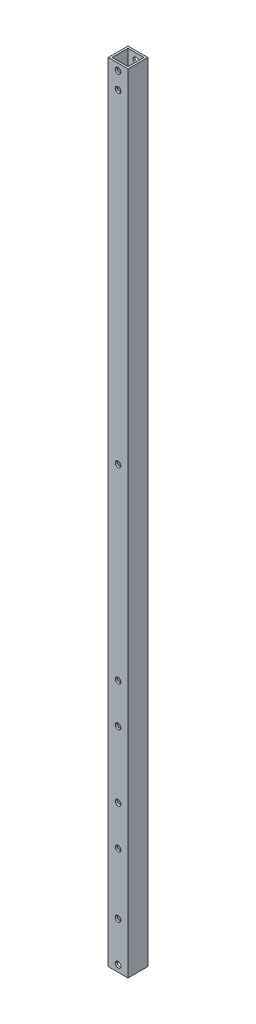
from build123d import *

# Parameters (mm, degrees)
SKETCH_1_W          = 15
SKETCH_1_H          = 15
SKETCH_1_W_2        = 12
SKETCH_1_H_2        = 12
EXTRUDE_1_DEPTH     = 595
CUT_EXTRUDE_2_REACH = 597.378
SKETCH_3_R          = 2.15
SKETCH_4_R          = 2.15
CUT_EXTRUDE_3_DEPTH = 596.37803117


with BuildPart() as part:
    # ｽｹｯﾁ1 → 押し出し-薄板1 (new body)
    with BuildSketch(Plane(origin=(0, 0, 0), x_dir=(1, 0, 0), z_dir=(0, 1, 0))):
        with Locations((7.5, 7.5)):
            Rectangle(SKETCH_1_W, SKETCH_1_H)
        with Locations((7.5, 7.5)):
            Rectangle(SKETCH_1_W_2, SKETCH_1_H_2, mode=Mode.SUBTRACT)
    extrude(amount=EXTRUDE_1_DEPTH)

    # ｶｯﾄ - 押し出し2: up to this face of the body (flat: up to its plane)
    cut_extrude_2_end = Plane(part.part.faces().sort_by_distance((7.5, 297.5, -15))[0])
    # ｽｹｯﾁ3 → ｶｯﾄ - 押し出し2 (cut, up to the picked face)
    with BuildSketch(Plane.XY, mode=Mode.PRIVATE) as cut_extrude_2_sk1:
        with Locations((7.5, 81)):
            Circle(SKETCH_3_R)
    cut_extrude_2_tool1 = split(extrude(cut_extrude_2_sk1.sketch, amount=-CUT_EXTRUDE_2_REACH, mode=Mode.PRIVATE), bisect_by=cut_extrude_2_end, keep=Keep.BOTH, mode=Mode.PRIVATE)
    # ｽｹｯﾁ3 → ｶｯﾄ - 押し出し2 (cut, up to the picked face)
    with BuildSketch(Plane.XY, mode=Mode.PRIVATE) as cut_extrude_2_sk2:
        with Locations((7.5, 111)):
            Circle(SKETCH_3_R)
    cut_extrude_2_tool2 = split(extrude(cut_extrude_2_sk2.sketch, amount=-CUT_EXTRUDE_2_REACH, mode=Mode.PRIVATE), bisect_by=cut_extrude_2_end, keep=Keep.BOTH, mode=Mode.PRIVATE)
    # ｽｹｯﾁ3 → ｶｯﾄ - 押し出し2 (cut, up to the picked face)
    with BuildSketch(Plane.XY, mode=Mode.PRIVATE) as cut_extrude_2_sk3:
        with Locations((7.5, 161)):
            Circle(SKETCH_3_R)
    cut_extrude_2_tool3 = split(extrude(cut_extrude_2_sk3.sketch, amount=-CUT_EXTRUDE_2_REACH, mode=Mode.PRIVATE), bisect_by=cut_extrude_2_end, keep=Keep.BOTH, mode=Mode.PRIVATE)
    # ｽｹｯﾁ3 → ｶｯﾄ - 押し出し2 (cut, up to the picked face)
    with BuildSketch(Plane.XY, mode=Mode.PRIVATE) as cut_extrude_2_sk4:
        with Locations((7.5, 191)):
            Circle(SKETCH_3_R)
    cut_extrude_2_tool4 = split(extrude(cut_extrude_2_sk4.sketch, amount=-CUT_EXTRUDE_2_REACH, mode=Mode.PRIVATE), bisect_by=cut_extrude_2_end, keep=Keep.BOTH, mode=Mode.PRIVATE)
    # ｽｹｯﾁ3 → ｶｯﾄ - 押し出し2 (cut, up to the picked face)
    with BuildSketch(Plane.XY, mode=Mode.PRIVATE) as cut_extrude_2_sk5:
        with Locations((7.5, 5)):
            Circle(SKETCH_3_R)
    cut_extrude_2_tool5 = split(extrude(cut_extrude_2_sk5.sketch, amount=-CUT_EXTRUDE_2_REACH, mode=Mode.PRIVATE), bisect_by=cut_extrude_2_end, keep=Keep.BOTH, mode=Mode.PRIVATE)
    # ｽｹｯﾁ3 → ｶｯﾄ - 押し出し2 (cut, up to the picked face)
    with BuildSketch(Plane.XY, mode=Mode.PRIVATE) as cut_extrude_2_sk6:
        with Locations((7.5, 35)):
            Circle(SKETCH_3_R)
    cut_extrude_2_tool6 = split(extrude(cut_extrude_2_sk6.sketch, amount=-CUT_EXTRUDE_2_REACH, mode=Mode.PRIVATE), bisect_by=cut_extrude_2_end, keep=Keep.BOTH, mode=Mode.PRIVATE)
    add(cut_extrude_2_tool1.solids().sort_by(Axis((7.5, 81, 0), (0, 0, -1)))[0], mode=Mode.SUBTRACT)
    add(cut_extrude_2_tool2.solids().sort_by(Axis((7.5, 111, 0), (0, 0, -1)))[0], mode=Mode.SUBTRACT)
    add(cut_extrude_2_tool3.solids().sort_by(Axis((7.5, 161, 0), (0, 0, -1)))[0], mode=Mode.SUBTRACT)
    add(cut_extrude_2_tool4.solids().sort_by(Axis((7.5, 191, 0), (0, 0, -1)))[0], mode=Mode.SUBTRACT)
    add(cut_extrude_2_tool5.solids().sort_by(Axis((7.5, 5, 0), (0, 0, -1)))[0], mode=Mode.SUBTRACT)
    add(cut_extrude_2_tool6.solids().sort_by(Axis((7.5, 35, 0), (0, 0, -1)))[0], mode=Mode.SUBTRACT)

    # ｽｹｯﾁ4 → ｶｯﾄ - 押し出し3 (cut, through all)
    with BuildSketch(Plane(origin=(15, 0, 0), x_dir=(-1, 0, 0), z_dir=(0, 0, -1))):
        with Locations(Location((7.5, 577.5, 0), (0, 0, 180))):
            Circle(SKETCH_4_R)
        with Locations(Location((7.5, 590, 0), (0, 0, 180))):
            Circle(SKETCH_4_R)
        with Locations(Location((7.5, 332.5, 0), (0, 0, 180))):
            Circle(SKETCH_4_R)
    extrude(amount=CUT_EXTRUDE_3_DEPTH, mode=Mode.SUBTRACT)


solid = part.part
